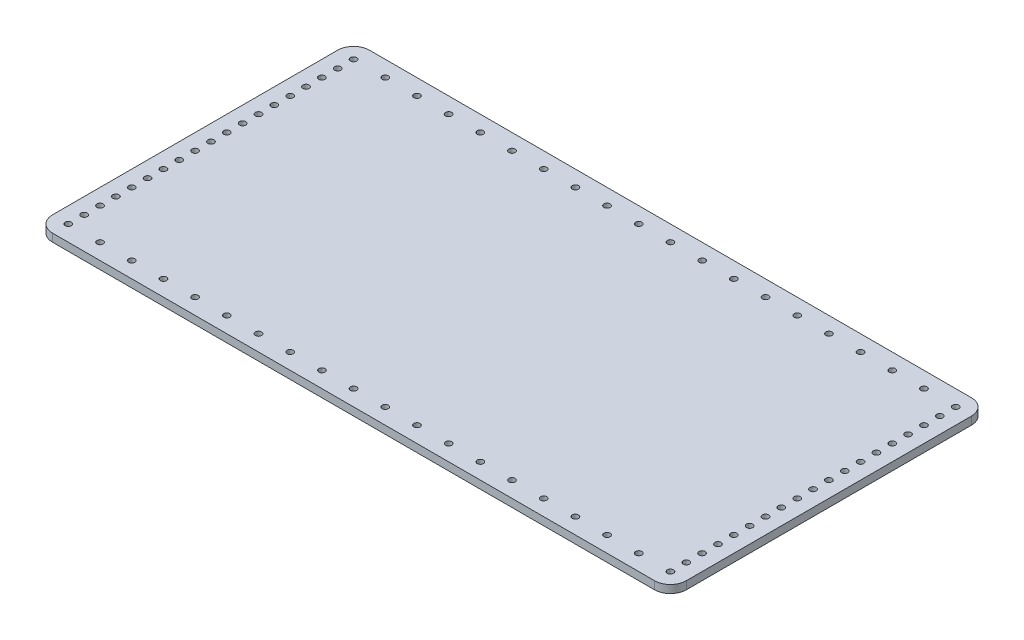
from build123d import *

# Parameters (mm, degrees)
SKETCH1_W           = 508
SKETCH1_H           = 254
BOSS_EXTRUDE1_DEPTH = 6.35
FILLET1_R           = 12.7
SKETCH3_R           = 2.4892
CUT_EXTRUDE2_DEPTH  = 568.996762755


with BuildPart() as part:
    # Sketch1 → Boss-Extrude1 (new body)
    with BuildSketch(Plane(origin=(0, 0, 0), x_dir=(1, 0, 0), z_dir=(0, 1, 0))):
        with Locations((254, 127)):
            Rectangle(SKETCH1_W, SKETCH1_H)
    extrude(amount=BOSS_EXTRUDE1_DEPTH)

    # Fillet1
    fillet1_edges = [part.edges().sort_by_distance(p)[0] for p in [
        (0, 3.175, -254),
        (508, 3.175, -254),
        (508, 3.175, 0),
        (0, 3.175, 0),
    ]]
    fillet(fillet1_edges, radius=FILLET1_R)

    # Sketch3 → Cut-Extrude2 (cut, through all)
    with BuildSketch(Plane(origin=(0, 6.35, 0), x_dir=(1, 0, 0), z_dir=(0, 1, 0))):
        with Locations(Location((12.7, 203.2, 0), (0, 0, 270))):
            Circle(SKETCH3_R)
        with Locations(Location((12.7, 215.9, 0), (0, 0, 270))):
            Circle(SKETCH3_R)
        with Locations(Location((12.7, 228.6, 0), (0, 0, 270))):
            Circle(SKETCH3_R)
        with Locations(Location((12.7, 241.3, 0), (0, 0, 270))):
            Circle(SKETCH3_R)
        with Locations(Location((38.1, 241.3, 0), (0, 0, 270))):
            Circle(SKETCH3_R)
        with Locations(Location((63.5, 241.3, 0), (0, 0, 270))):
            Circle(SKETCH3_R)
        with Locations(Location((88.9, 241.3, 0), (0, 0, 270))):
            Circle(SKETCH3_R)
        with Locations(Location((114.3, 241.3, 0), (0, 0, 270))):
            Circle(SKETCH3_R)
        with Locations(Location((12.7, 12.7, 0), (0, 0, 270))):
            Circle(SKETCH3_R)
        with Locations(Location((12.7, 25.4, 0), (0, 0, 270))):
            Circle(SKETCH3_R)
        with Locations(Location((12.7, 38.1, 0), (0, 0, 270))):
            Circle(SKETCH3_R)
        with Locations(Location((12.7, 50.8, 0), (0, 0, 270))):
            Circle(SKETCH3_R)
        with Locations(Location((12.7, 63.5, 0), (0, 0, 270))):
            Circle(SKETCH3_R)
        with Locations(Location((38.1, 12.7, 0), (0, 0, 270))):
            Circle(SKETCH3_R)
        with Locations(Location((63.5, 12.7, 0), (0, 0, 270))):
            Circle(SKETCH3_R)
        with Locations(Location((88.9, 12.7, 0), (0, 0, 270))):
            Circle(SKETCH3_R)
        with Locations(Location((12.7, 101.6, 0), (0, 0, 270))):
            Circle(SKETCH3_R)
        with Locations(Location((12.7, 114.3, 0), (0, 0, 270))):
            Circle(SKETCH3_R)
        with Locations(Location((12.7, 127, 0), (0, 0, 270))):
            Circle(SKETCH3_R)
        with Locations(Location((12.7, 139.7, 0), (0, 0, 270))):
            Circle(SKETCH3_R)
        with Locations(Location((12.7, 165.1, 0), (0, 0, 270))):
            Circle(SKETCH3_R)
        with Locations(Location((12.7, 152.4, 0), (0, 0, 270))):
            Circle(SKETCH3_R)
        with Locations(Location((12.7, 177.8, 0), (0, 0, 270))):
            Circle(SKETCH3_R)
        with Locations(Location((12.7, 190.5, 0), (0, 0, 270))):
            Circle(SKETCH3_R)
        with Locations(Location((12.7, 88.9, 0), (0, 0, 270))):
            Circle(SKETCH3_R)
        with Locations(Location((12.7, 76.2, 0), (0, 0, 270))):
            Circle(SKETCH3_R)
        with Locations(Location((495.3, 12.7, 0), (0, 0, 270))):
            Circle(SKETCH3_R)
        with Locations(Location((469.9, 12.7, 0), (0, 0, 270))):
            Circle(SKETCH3_R)
        with Locations(Location((444.5, 12.7, 0), (0, 0, 270))):
            Circle(SKETCH3_R)
        with Locations(Location((419.1, 12.7, 0), (0, 0, 270))):
            Circle(SKETCH3_R)
        with Locations(Location((393.7, 12.7, 0), (0, 0, 270))):
            Circle(SKETCH3_R)
        with Locations(Location((368.3, 12.7, 0), (0, 0, 270))):
            Circle(SKETCH3_R)
        with Locations(Location((342.9, 12.7, 0), (0, 0, 270))):
            Circle(SKETCH3_R)
        with Locations(Location((317.5, 12.7, 0), (0, 0, 270))):
            Circle(SKETCH3_R)
        with Locations(Location((292.1, 12.7, 0), (0, 0, 270))):
            Circle(SKETCH3_R)
        with Locations(Location((266.7, 12.7, 0), (0, 0, 270))):
            Circle(SKETCH3_R)
        with Locations(Location((241.3, 12.7, 0), (0, 0, 270))):
            Circle(SKETCH3_R)
        with Locations(Location((215.9, 12.7, 0), (0, 0, 270))):
            Circle(SKETCH3_R)
        with Locations(Location((114.3, 12.7, 0), (0, 0, 270))):
            Circle(SKETCH3_R)
        with Locations(Location((139.7, 12.7, 0), (0, 0, 270))):
            Circle(SKETCH3_R)
        with Locations(Location((165.1, 12.7, 0), (0, 0, 270))):
            Circle(SKETCH3_R)
        with Locations(Location((190.5, 12.7, 0), (0, 0, 270))):
            Circle(SKETCH3_R)
        with Locations(Location((139.7, 241.3, 0), (0, 0, 270))):
            Circle(SKETCH3_R)
        with Locations(Location((165.1, 241.3, 0), (0, 0, 270))):
            Circle(SKETCH3_R)
        with Locations(Location((190.5, 241.3, 0), (0, 0, 270))):
            Circle(SKETCH3_R)
        with Locations(Location((215.9, 241.3, 0), (0, 0, 270))):
            Circle(SKETCH3_R)
        with Locations(Location((241.3, 241.3, 0), (0, 0, 270))):
            Circle(SKETCH3_R)
        with Locations(Location((266.7, 241.3, 0), (0, 0, 270))):
            Circle(SKETCH3_R)
        with Locations(Location((292.1, 241.3, 0), (0, 0, 270))):
            Circle(SKETCH3_R)
        with Locations(Location((317.5, 241.3, 0), (0, 0, 270))):
            Circle(SKETCH3_R)
        with Locations(Location((342.9, 241.3, 0), (0, 0, 270))):
            Circle(SKETCH3_R)
        with Locations(Location((368.3, 241.3, 0), (0, 0, 270))):
            Circle(SKETCH3_R)
        with Locations(Location((393.7, 241.3, 0), (0, 0, 270))):
            Circle(SKETCH3_R)
        with Locations(Location((419.1, 241.3, 0), (0, 0, 270))):
            Circle(SKETCH3_R)
        with Locations(Location((444.5, 241.3, 0), (0, 0, 270))):
            Circle(SKETCH3_R)
        with Locations(Location((469.9, 241.3, 0), (0, 0, 270))):
            Circle(SKETCH3_R)
        with Locations(Location((495.3, 241.3, 0), (0, 0, 270))):
            Circle(SKETCH3_R)
        with Locations(Location((495.3, 25.4, 0), (0, 0, 270))):
            Circle(SKETCH3_R)
        with Locations(Location((495.3, 38.1, 0), (0, 0, 270))):
            Circle(SKETCH3_R)
        with Locations(Location((495.3, 50.8, 0), (0, 0, 270))):
            Circle(SKETCH3_R)
        with Locations(Location((495.3, 101.6, 0), (0, 0, 270))):
            Circle(SKETCH3_R)
        with Locations(Location((495.3, 88.9, 0), (0, 0, 270))):
            Circle(SKETCH3_R)
        with Locations(Location((495.3, 76.2, 0), (0, 0, 270))):
            Circle(SKETCH3_R)
        with Locations(Location((495.3, 63.5, 0), (0, 0, 270))):
            Circle(SKETCH3_R)
        with Locations(Location((495.3, 114.3, 0), (0, 0, 270))):
            Circle(SKETCH3_R)
        with Locations(Location((495.3, 127, 0), (0, 0, 270))):
            Circle(SKETCH3_R)
        with Locations(Location((495.3, 139.7, 0), (0, 0, 270))):
            Circle(SKETCH3_R)
        with Locations(Location((495.3, 152.4, 0), (0, 0, 270))):
            Circle(SKETCH3_R)
        with Locations(Location((495.3, 165.1, 0), (0, 0, 270))):
            Circle(SKETCH3_R)
        with Locations(Location((495.3, 177.8, 0), (0, 0, 270))):
            Circle(SKETCH3_R)
        with Locations(Location((495.3, 190.5, 0), (0, 0, 270))):
            Circle(SKETCH3_R)
        with Locations(Location((495.3, 203.2, 0), (0, 0, 270))):
            Circle(SKETCH3_R)
        with Locations(Location((495.3, 228.6, 0), (0, 0, 270))):
            Circle(SKETCH3_R)
        with Locations(Location((495.3, 215.9, 0), (0, 0, 270))):
            Circle(SKETCH3_R)
    extrude(amount=-CUT_EXTRUDE2_DEPTH, mode=Mode.SUBTRACT)


solid = part.part
